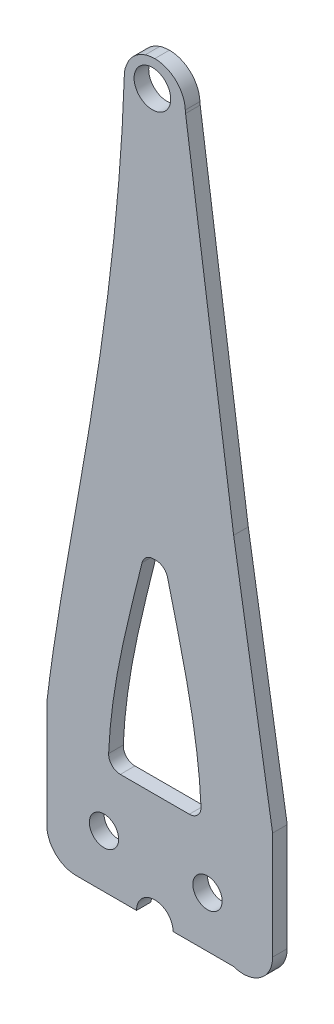
from build123d import *

# Parameters (mm, degrees)
BOSS_EXTRUDE1_DEPTH = 1.27
CUT_EXTRUDE2_DEPTH  = 64.13835029
SKETCH4_R           = 1.27
SKETCH4_R_2         = 1.5875
CUT_EXTRUDE3_DEPTH  = 64.13835029


with BuildPart() as part:
    # Sketch1 → Boss-Extrude1 (new body)
    with BuildSketch(Plane.XY):
        with BuildLine():
            Line((-6.832612328, -62.148292065), (6.8326, -62.148292065))
            ThreePointArc((6.8326, -62.148292065), (9.145004667, -61.82662212), (10.217979737, -59.753119914))
            Line((10.217979737, -59.753119914), (10.217979737, -50.431712328))
            Line((10.217979737, -50.431712328), (6.839792065, -29.750592065))
            Line((6.839792065, -29.750592065), (2.667806008, -0.146870092))
            ThreePointArc((2.667806008, -0.146870092), (2.653236727, -0.020752709), (2.644987367, 0.105935121))
            ThreePointArc((2.644987367, 0.105935121), (1.833951843, 1.908874292), (0, 2.647107935))
            add(Edge.make_bspline(
                [(0, 2.647107935), (-0.561984482, 2.60663561), (-0.837703259, 2.51106226)],
                knots=[0, 0, 0, 0.00724911, 0.00724911, 0.00724911], degree=2))
            ThreePointArc((-0.837703259, 2.51106226), (-1.617455697, 2.09547548), (-2.216994409, 1.446414952))
            add(Edge.make_bspline(
                [(-2.216994409, 1.446414952), (-2.348446751, 1.249612458), (-2.562206256, 0.722759125), (-2.600800514, 0.492967657)],
                knots=[0.022131974, 0.022131974, 0.022131974, 0.022131974, 0.030911059, 0.030911059, 0.030911059, 0.030911059], degree=3))
            ThreePointArc((-2.600800514, 0.492967657), (-2.63362686, 0.266814516), (-2.646825425, 0.038672871))
            ThreePointArc((-2.646825425, 0.038672871), (-2.647287537, 0.01475577), (-2.647974875, -0.009155919))
            add(Edge.make_bspline(
                [(-2.647974875, -0.009155919), (-2.982966974, -10.021345785), (-5.211696232, -26.748717576), (-8.559038061, -43.581295567), (-9.3726, -50.4317)],
                knots=[0.035874882, 0.035874882, 0.035874882, 0.035874882, 0.412185068, 0.675162616, 0.675162616, 0.675162616, 0.675162616], degree=3))
            Line((-9.3726, -50.4317), (-9.3726, -59.608304393))
            ThreePointArc((-9.3726, -59.608304393), (-8.628654835, -61.4043469), (-6.832612328, -62.148292065))
        make_face()
    extrude(amount=BOSS_EXTRUDE1_DEPTH)

    # Sketch2 → Cut-Extrude2 (cut, through all)
    with BuildSketch(Plane.XY.offset(1.27)):
        with BuildLine():
            ThreePointArc((1.5875, -62.148292065), (0, -60.560792065), (-1.5875, -62.148292065))
            Line((-1.5875, -62.148292065), (1.5875, -62.148292065))
        make_face()
        with BuildLine():
            Line((-2.993002621, -52.629071042), (2.993002621, -52.629071042))
            ThreePointArc((2.993002621, -52.629071042), (3.726800948, -52.31577725), (4.008051125, -51.569110442))
            add(Edge.make_bspline(
                [(4.008051125, -51.569110442), (3.970454208, -50.700999098), (3.762157848, -48.039220625), (3.064677271, -43.892588352), (2.039593657, -39.517305496), (1.382803309, -36.905376029), (1.10391193, -35.774249306)],
                knots=[0.059039804, 0.059039804, 0.059039804, 0.059039804, 0.20424764, 0.505314101, 0.760840146, 0.955648589, 0.955648589, 0.955648589, 0.955648589], degree=3))
            ThreePointArc((1.10391193, -35.774249306), (0.744009182, -35.217668165), (0.11745403, -35.001471042))
            Line((0.11745403, -35.001471042), (-0.11745403, -35.001471042))
            ThreePointArc((-0.11745403, -35.001471042), (-0.744009182, -35.217668165), (-1.10391193, -35.774249306))
            add(Edge.make_bspline(
                [(-4.008051125, -51.569110442), (-3.970454208, -50.700999098), (-3.762157848, -48.039220625), (-3.064677271, -43.892588352), (-2.039593657, -39.517305496), (-1.382803309, -36.905376029), (-1.10391193, -35.774249306)],
                knots=[0.059039804, 0.059039804, 0.059039804, 0.059039804, 0.20424764, 0.505314101, 0.760840146, 0.955648589, 0.955648589, 0.955648589, 0.955648589], degree=3))
            ThreePointArc((-4.008051125, -51.569110442), (-3.726800948, -52.31577725), (-2.993002621, -52.629071042))
        make_face()
    extrude(amount=-CUT_EXTRUDE2_DEPTH, mode=Mode.SUBTRACT)

    # Sketch4 → Cut-Extrude3 (cut, through all)
    with BuildSketch(Plane(origin=(0, 0, 0), x_dir=(-1, 0, 0), z_dir=(0, 0, -1))):
        with Locations((4.407451174, -57.57698217)):
            Circle(SKETCH4_R)
        with Locations((-4.571309894, -57.740840891)):
            Circle(SKETCH4_R)
        with Locations((0.210042576, 0.287306268)):
            Circle(SKETCH4_R_2)
    extrude(amount=-CUT_EXTRUDE3_DEPTH, mode=Mode.SUBTRACT)


solid = part.part
